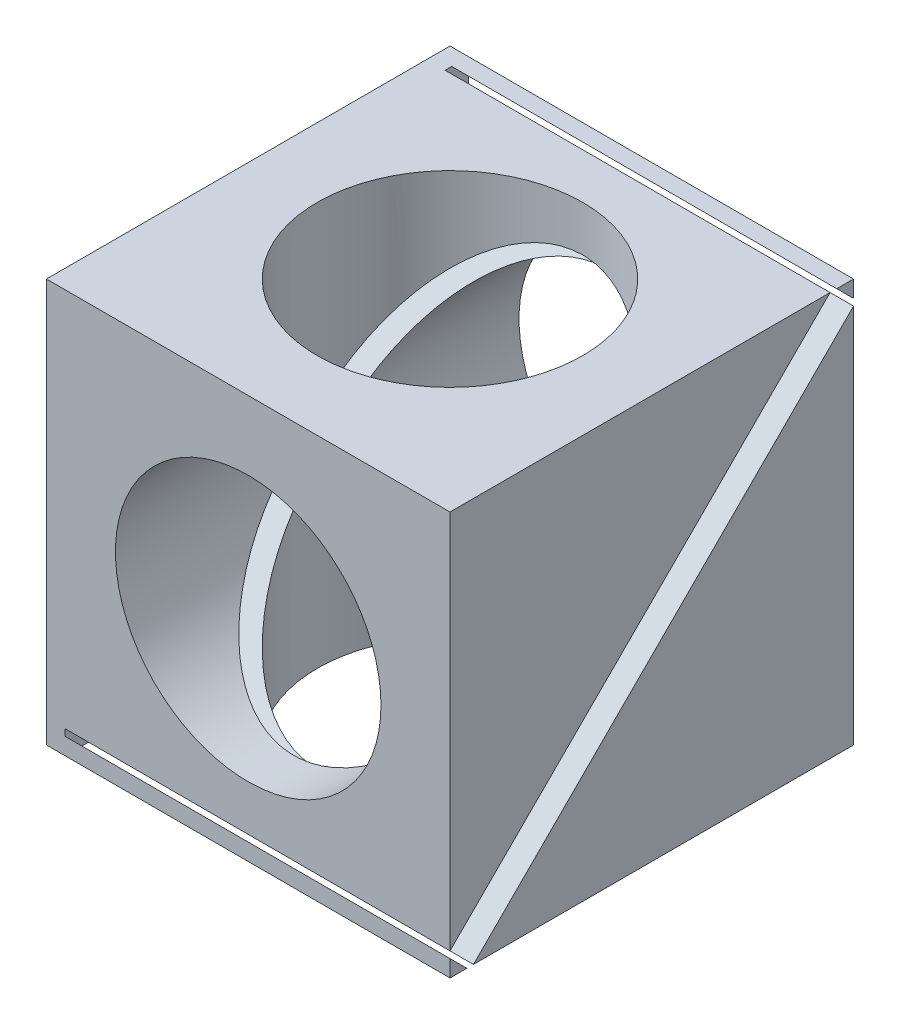
from build123d import *

# Parameters (mm, degrees)
SKETCH1_W               = 38.608
SKETCH1_H               = 38.608
BOSS_EXTRUDE1_DEPTH     = 19.304
CUT_EXTRUDE1_DEPTH      = 34.435508789
CUT_EXTRUDE1_DEPTH_BACK = 34.435508789
SKETCH2_R               = 12.7
CUT_EXTRUDE3_DEPTH      = 48.284949995
CUT_EXTRUDE3_DEPTH_BACK = 48.284949995
SKETCH3_R               = 12.7
CUT_EXTRUDE4_DEPTH      = 17.526
CUT_EXTRUDE5_DEPTH      = 34.435508789


with BuildPart() as part:
    # Sketch1 → Boss-Extrude1 (new, symmetric)
    with BuildSketch(Plane(origin=(0, 0, 0), x_dir=(1, 0, 0), z_dir=(0, 1, 0))):
        Rectangle(SKETCH1_W, SKETCH1_H)
    extrude(amount=BOSS_EXTRUDE1_DEPTH, both=True)

    # Sketch2 → Cut-Extrude1 (cut, two sides: drawn at the far end of the back side and taken through both)
    with BuildSketch(Plane.XY.offset(-CUT_EXTRUDE1_DEPTH_BACK)):
        Circle(SKETCH2_R)
    extrude(amount=CUT_EXTRUDE1_DEPTH + CUT_EXTRUDE1_DEPTH_BACK, mode=Mode.SUBTRACT)

    # Sketch3 → Cut-Extrude3 (cut, two sides: drawn at the far end of the back side and taken through both)
    with BuildSketch(Plane(origin=(0, 19.304, 0), x_dir=(0, 0, -1), z_dir=(0, -1, 0)).offset(-CUT_EXTRUDE3_DEPTH_BACK)):
        Circle(SKETCH3_R)
    extrude(amount=CUT_EXTRUDE3_DEPTH + CUT_EXTRUDE3_DEPTH_BACK, mode=Mode.SUBTRACT)

    # Sketch4 → Cut-Extrude4 (cut, symmetric)
    with BuildSketch(Plane(origin=(0, 0, 0), x_dir=(0, 0, -1), z_dir=(1, 0, 0))):
        Polygon((-17.376795594, -19.621859625), (19.621859625, 17.376795594), (17.376795594, 19.621859625), (-19.621859625, -17.376795594), align=None)
    extrude(amount=CUT_EXTRUDE4_DEPTH, both=True, mode=Mode.SUBTRACT)

    # Sketch4<2> → Cut-Extrude5 (cut, through all)
    with BuildSketch(Plane(origin=(0, 0, 0), x_dir=(0, 0, -1), z_dir=(1, 0, 0))):
        Polygon((-17.376795594, -19.621859625), (19.621859625, 17.376795594), (17.376795594, 19.621859625), (-19.621859625, -17.376795594), align=None)
    extrude(amount=CUT_EXTRUDE5_DEPTH, mode=Mode.SUBTRACT)


solid = part.part
